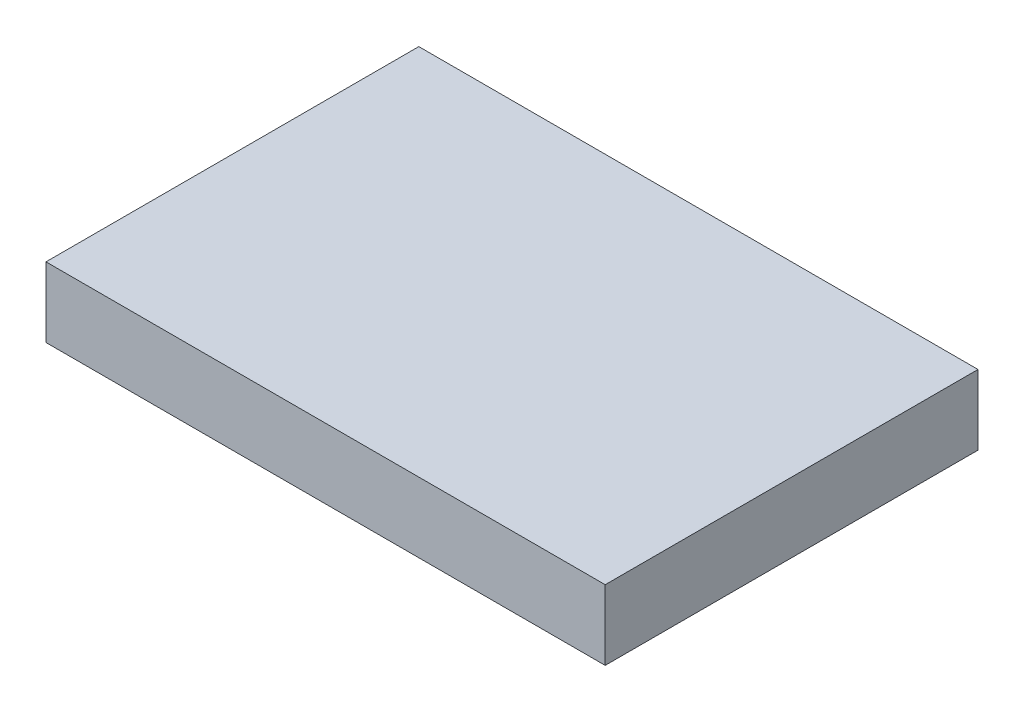
from build123d import *

# Parameters (mm, degrees)
TOPSKETCH_W         = 304.8
TOPSKETCH_H         = 203.2
BOSS_EXTRUDE1_DEPTH = 38.1


with BuildPart() as part:
    # TopSketch → Boss-Extrude1 (new body)
    with BuildSketch(Plane(origin=(0, 0, 0), x_dir=(1, 0, 0), z_dir=(0, 1, 0))):
        Rectangle(TOPSKETCH_W, TOPSKETCH_H)
    extrude(amount=BOSS_EXTRUDE1_DEPTH)


solid = part.part
